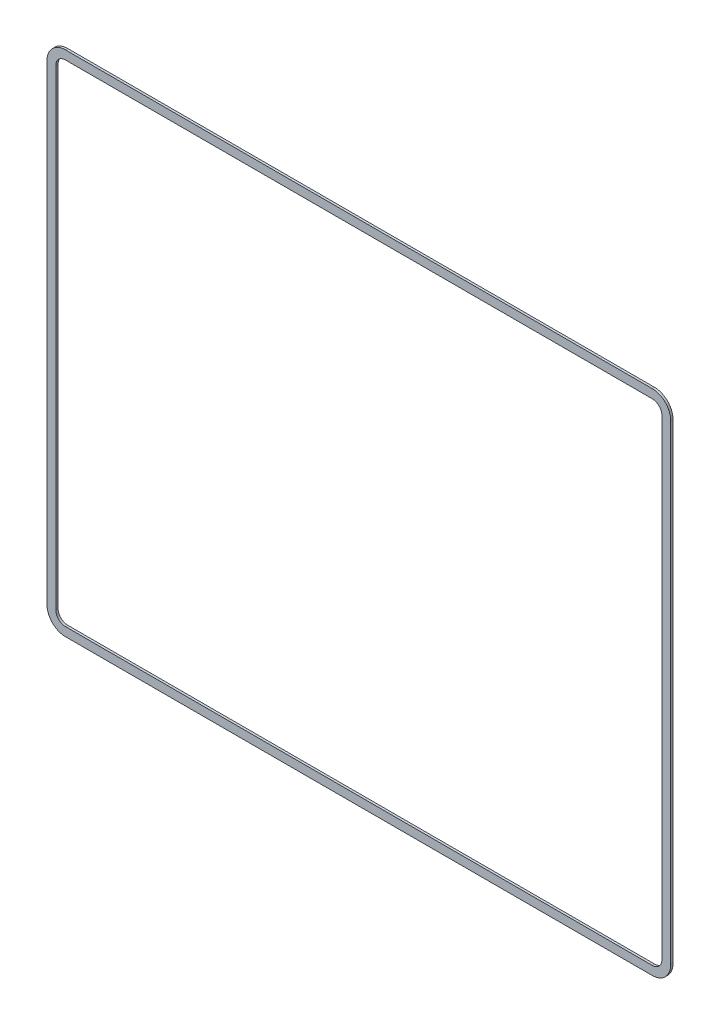
from build123d import *

# Parameters (mm, degrees)
BOSS_EXTRUDE1_DEPTH = 0.5


with BuildPart() as part:
    # Sketch1 → Boss-Extrude1 (new body)
    with BuildSketch(Plane(origin=(0, 0, 0), x_dir=(-1, 0, 0), z_dir=(0, 0, 1))):
        with BuildLine():
            Line((-63.5, 55), (63.5, 55))
            ThreePointArc((63.5, 55), (66.328427125, 53.828427125), (67.5, 51))
            Line((67.5, 51), (67.5, -51))
            ThreePointArc((67.5, -51), (66.328427125, -53.828427125), (63.5, -55))
            Line((63.5, -55), (-63.5, -55))
            ThreePointArc((-63.5, -55), (-66.328427125, -53.828427125), (-67.5, -51))
            Line((-67.5, -51), (-67.5, 51))
            ThreePointArc((-67.5, 51), (-66.328427125, 53.828427125), (-63.5, 55))
        make_face()
        with BuildLine():
            Line((-65.6, 51), (-65.6, -51))
            ThreePointArc((-65.6, -51), (-64.98492424, -52.48492424), (-63.5, -53.1))
            Line((-63.5, -53.1), (63.5, -53.1))
            ThreePointArc((63.5, -53.1), (64.98492424, -52.48492424), (65.6, -51))
            Line((65.6, -51), (65.6, 51))
            ThreePointArc((65.6, 51), (64.98492424, 52.48492424), (63.5, 53.1))
            Line((63.5, 53.1), (-63.5, 53.1))
            ThreePointArc((-63.5, 53.1), (-64.98492424, 52.48492424), (-65.6, 51))
        make_face(mode=Mode.SUBTRACT)
    extrude(amount=BOSS_EXTRUDE1_DEPTH)


solid = part.part
